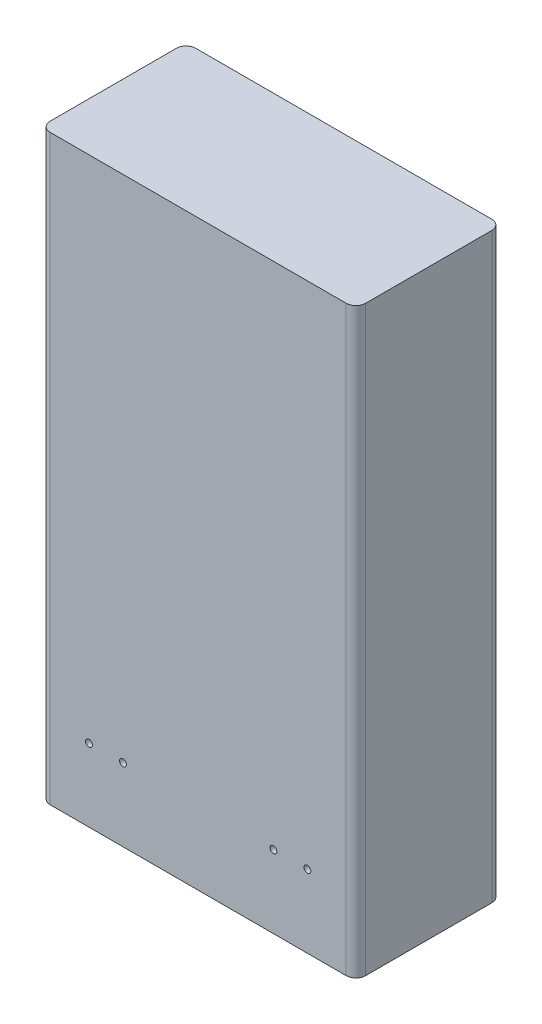
from build123d import *

# Parameters (mm, degrees)
SKETCH1_W           = 82.55
SKETCH1_H           = 152.4
BOSS_EXTRUDE1_DEPTH = 19.05
SKETCH2_R           = 0.889
CUT_EXTRUDE1_DEPTH  = 95.666127126
FILLET1_R           = 2.54


with BuildPart() as part:
    # Sketch1 → Boss-Extrude1 (new, symmetric)
    with BuildSketch(Plane.XY):
        Rectangle(SKETCH1_W, SKETCH1_H)
    extrude(amount=BOSS_EXTRUDE1_DEPTH, both=True)

    # Sketch2 → Cut-Extrude1 (cut, through all)
    with BuildSketch(Plane.XY.offset(19.05)):
        with Locations((-28.575, -57.15)):
            Circle(SKETCH2_R)
        with Locations((-19.685, -57.15)):
            Circle(SKETCH2_R)
        with Locations((28.575, -57.15)):
            Circle(SKETCH2_R)
        with Locations((19.685, -57.15)):
            Circle(SKETCH2_R)
    extrude(amount=-CUT_EXTRUDE1_DEPTH, mode=Mode.SUBTRACT)

    # Fillet1
    fillet1_edges = [part.edges().sort_by_distance(p)[0] for p in [
        (-41.275, 0, 19.05),
        (41.275, 0, 19.05),
        (-41.275, 0, -19.05),
        (41.275, 0, -19.05),
    ]]
    fillet(fillet1_edges, radius=FILLET1_R)


solid = part.part
